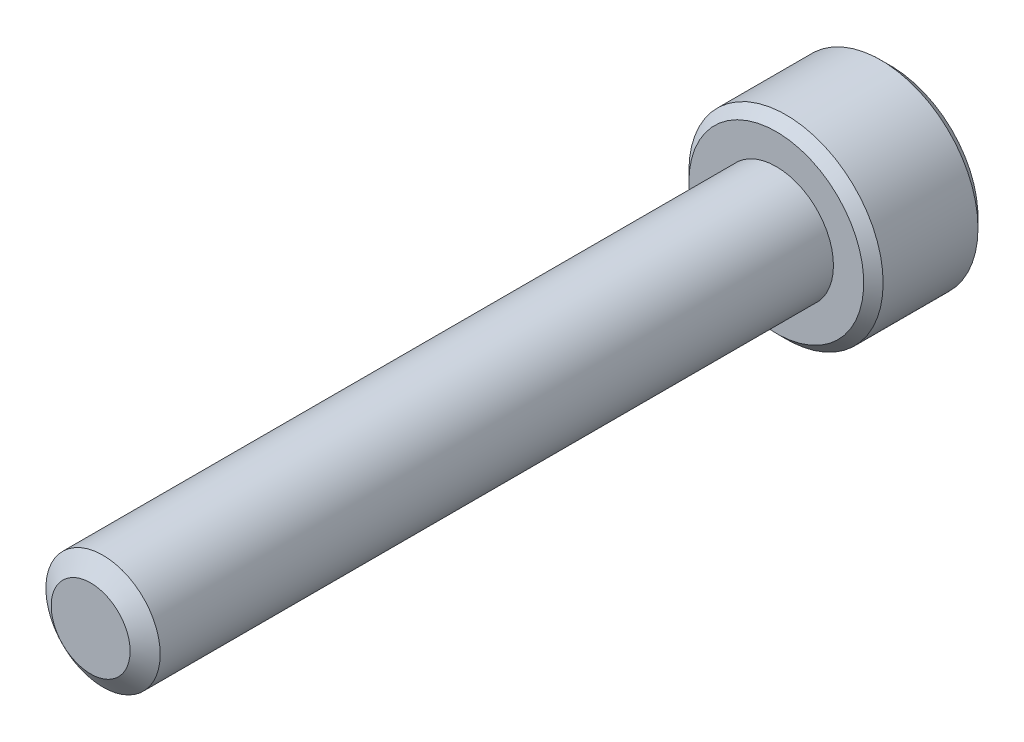
from build123d import *

# Parameters (mm, degrees)
SKETCH1_R          = 2.5
EXTRUDE1_DEPTH     = 30
SKETCH6_R          = 4.25
EXTRUDE2_DEPTH     = 5
CUT_EXTRUDE1_DEPTH = 3
CHAMFER1_SIZE      = 0.425


with BuildPart() as part:
    # Sketch1 → Extrude1 (new body)
    with BuildSketch(Plane.XY):
        Circle(SKETCH1_R)
    extrude(amount=-EXTRUDE1_DEPTH)

    # Sketch4 → Cut-Revolve1 (revolve, cut)
    with BuildSketch(Plane(origin=(0, 0, 0), x_dir=(0, 0, -1), z_dir=(1, 0, 0))):
        Polygon((0.541691224, 2.5), (0, 1.726384758), (0, 2.5), align=None)
    revolve(axis=Axis((0, 0, 0), (0, 0, -1)), mode=Mode.SUBTRACT)

    # Sketch6 → Extrude2 (add)
    with BuildSketch(Plane(origin=(0, 0, -30), x_dir=(-1, 0, 0), z_dir=(0, 0, -1))):
        Circle(SKETCH6_R)
    extrude(amount=EXTRUDE2_DEPTH)

    # Sketch7 → Cut-Extrude1 (cut)
    with BuildSketch(Plane(origin=(0, 0, -35), x_dir=(-1, 0, 0), z_dir=(0, 0, -1))):
        Polygon((0, 2.309401077), (-2, 1.154700538), (-2, -1.154700538), (0, -2.309401077), (2, -1.154700538), (2, 1.154700538), align=None)
    extrude(amount=-CUT_EXTRUDE1_DEPTH, mode=Mode.SUBTRACT)

    # Cut-Extrude2 cone 1 section (through the dimple's axis) → Cut-Extrude2 (revolve, cut)
    with BuildSketch(Plane(origin=(0, 0, -35), x_dir=(0, 1, 0), z_dir=(1, 0, 0))):
        Polygon((0, 0), (2.309401077, 0), (0, 2.309401077), align=None)
    revolve(axis=Axis((0, 0, -35), (0, 0, 1)), mode=Mode.SUBTRACT)

    # Chamfer1
    chamfer1_edges = [part.edges().sort_by_distance(p)[0] for p in [
        (4.25, 0, -35),
        (4.25, 0, -30),
    ]]
    chamfer(chamfer1_edges, length=CHAMFER1_SIZE)


solid = part.part
